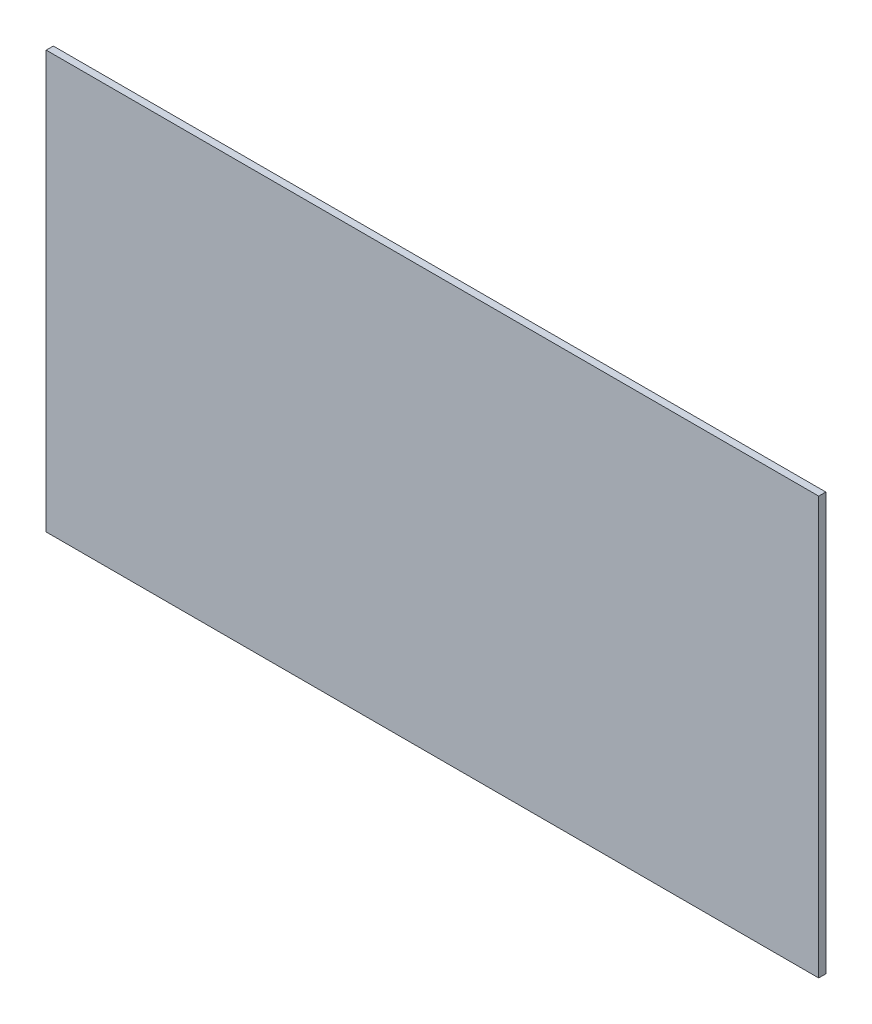
from build123d import *

# Parameters (mm, degrees)
SKETCH1_W           = 435
SKETCH1_H           = 235
BOSS_EXTRUDE1_DEPTH = 4


with BuildPart() as part:
    # Sketch1 → Boss-Extrude1 (new body)
    with BuildSketch(Plane.XY):
        Rectangle(SKETCH1_W, SKETCH1_H)
    extrude(amount=BOSS_EXTRUDE1_DEPTH)


solid = part.part
